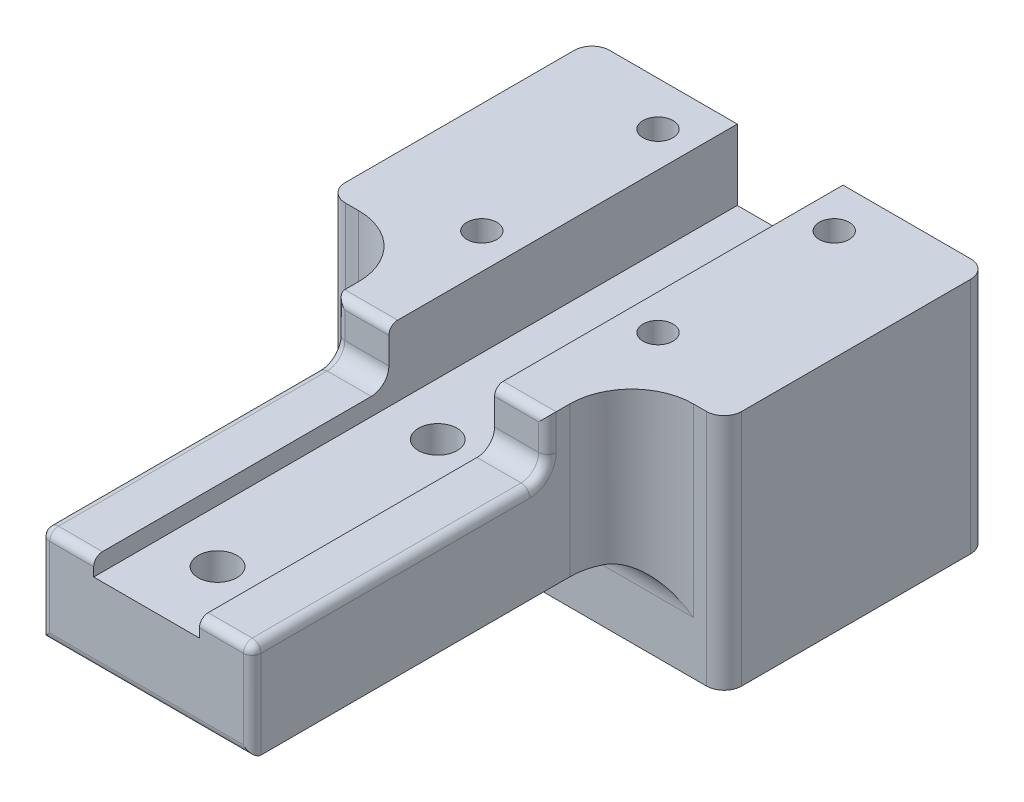
from build123d import *

# Parameters (mm, degrees)
SKETCH1_W           = 45
SKETCH1_H           = 30
SKETCH1_R           = 1.7
SKETCH1_W_2         = 24
SKETCH1_H_2         = 43.058371989
SKETCH1_R_2         = 2.2
BOSS_EXTRUDE2_DEPTH = 17
SKETCH5_W           = 12
SKETCH5_H           = 100
CUT_EXTRUDE1_DEPTH  = 8
SKETCH7_W           = 29.697028674
SKETCH7_H           = 34.988499238
CUT_EXTRUDE2_DEPTH  = 64.229934035
SKETCH9_W           = 45
SKETCH9_H           = 30
BOSS_EXTRUDE3_DEPTH = 10
FILLET1_R           = 7
FILLET6_R           = 2
FILLET7_R           = 1
FILLET8_R           = 4


with BuildPart() as part:
    # Sketch1 → Boss-Extrude2 (new body)
    # profile 1 of 2: a face of its own
    with BuildSketch(Plane(origin=(0, 0, 0), x_dir=(1, 0, 0), z_dir=(0, 1, 0))):
        Rectangle(SKETCH1_W, SKETCH1_H)
        with Locations(Location((-10, 10, 0), (0, 0, 270))):
            Circle(SKETCH1_R, mode=Mode.SUBTRACT)
        with Locations(Location((10, 10, 0), (0, 0, 270))):
            Circle(SKETCH1_R, mode=Mode.SUBTRACT)
        with Locations(Location((10, -10, 0), (0, 0, 270))):
            Circle(SKETCH1_R, mode=Mode.SUBTRACT)
        with Locations(Location((-10, -10, 0), (0, 0, 270))):
            Circle(SKETCH1_R, mode=Mode.SUBTRACT)
    # profile 2 of 2: a face of its own
    with BuildSketch(Plane(origin=(0, 0, 0), x_dir=(1, 0, 0), z_dir=(0, 1, 0))):
        with Locations((0, -36.529185995)):
            Rectangle(SKETCH1_W_2, SKETCH1_H_2)
        with Locations(Location((0, -25, 0), (0, 0, 270))):
            Circle(SKETCH1_R_2, mode=Mode.SUBTRACT)
        with Locations(Location((0, -50, 0), (0, 0, 270))):
            Circle(SKETCH1_R_2, mode=Mode.SUBTRACT)
    extrude(amount=-BOSS_EXTRUDE2_DEPTH)

    # Sketch5 → Cut-Extrude1 (cut)
    with BuildSketch(Plane(origin=(0, 0, 0), x_dir=(1, 0, 0), z_dir=(0, 1, 0))):
        with Locations((0, -16.465194583)):
            Rectangle(SKETCH5_W, SKETCH5_H)
    extrude(amount=-CUT_EXTRUDE1_DEPTH, mode=Mode.SUBTRACT)

    # Sketch7 → Cut-Extrude2 (cut, through all)
    with BuildSketch(Plane(origin=(0, -6, 0), x_dir=(1, 0, 0), z_dir=(0, 1, 0))):
        with Locations((-0.809918964, -42.047133079)):
            Rectangle(SKETCH7_W, SKETCH7_H)
    extrude(amount=CUT_EXTRUDE2_DEPTH, mode=Mode.SUBTRACT)

    # Sketch9 → Boss-Extrude3 (add)
    with BuildSketch(Plane.XZ.offset(17)):
        Rectangle(SKETCH9_W, SKETCH9_H)
    extrude(amount=BOSS_EXTRUDE3_DEPTH)

    # Fillet1
    fillet1_edges = [part.edges().sort_by_distance(p)[0] for p in [
        (-12, -8.5, 15),
        (12, -8.5, 15),
    ]]
    fillet(fillet1_edges, radius=FILLET1_R)

    # Fillet6
    fillet6_edges = [part.edges().sort_by_distance(p)[0] for p in [
        (22.5, -13.5, 15),
        (-22.5, -13.5, 15),
        (-22.5, -13.5, -15),
        (22.5, -13.5, -15),
        (9, -6, 24.55288346),
        (-9, -6, 24.55288346),
    ]]
    fillet(fillet6_edges, radius=FILLET6_R)

    # Fillet7
    fillet7_edges = [part.edges().sort_by_distance(p)[0] for p in [
        (-12, -2, 24.55288346),
        (12, -2, 24.55288346),
        (-12, -5.414213562, 25.138669897),
        (12, -5.414213562, 25.138669897),
        (-12, -11.5, 58.058371989),
        (12, -11.5, 58.058371989),
        (0, -17, 58.058371989),
        (9, 0, 24.55288346),
        (9, -6, 58.058371989),
        (12, -6, 42.305627724),
        (-9, 0, 24.55288346),
        (-9, -6, 58.058371989),
        (-12, -6, 42.305627724),
    ]]
    fillet(fillet7_edges, radius=FILLET7_R)

    # Fillet8
    fillet8_edges = [part.edges().sort_by_distance(p)[0] for p in [
        (0, -17, 15),
    ]]
    fillet(fillet8_edges, radius=FILLET8_R)


solid = part.part
